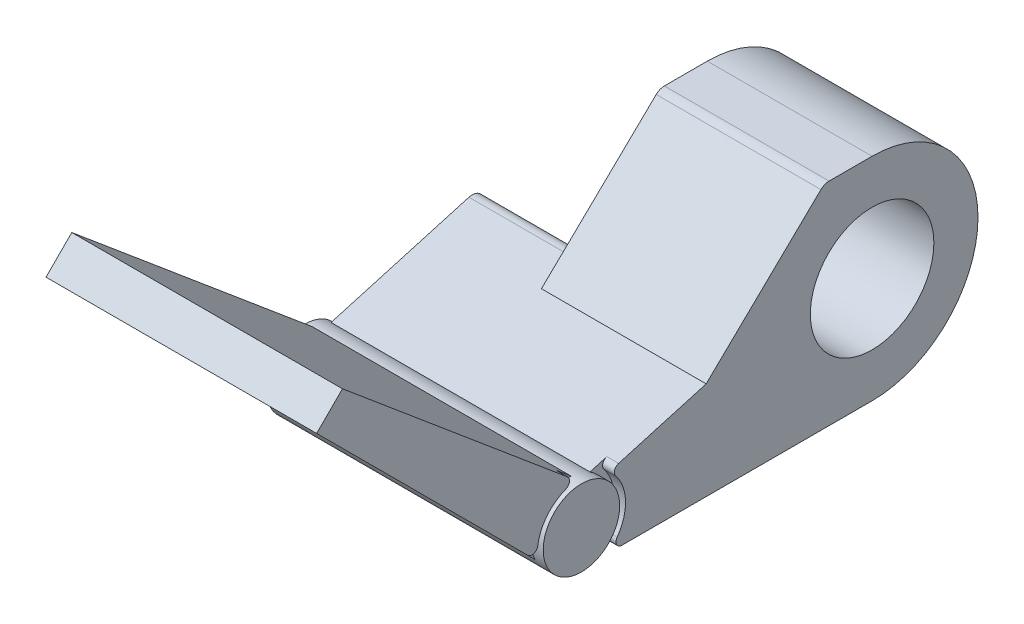
from build123d import *
from build123d.topology import SkipClean

# Parameters (mm, degrees)
SKETCH2_R           = 5.25
BOSS_EXTRUDE1_DEPTH = 14
CUT_EXTRUDE1_DEPTH  = 1
CUT_EXTRUDE2_DEPTH  = 1
BOSS_EXTRUDE2_DEPTH = 9
BOSS_EXTRUDE3_DEPTH = 9.5
FILLET1_R           = 1


with BuildPart() as part:
    # Sketch2 → Boss-Extrude1 (new body)
    with BuildSketch(Plane(origin=(0, 0, 0), x_dir=(0, 0, -1), z_dir=(1, 0, 0))):
        with BuildLine():
            ThreePointArc((0, 0), (9, 9), (0, 18))
            Line((0, 18), (-4.055356, 18))
            Line((-4.055356, 18), (-14.1, 8.3))
            Line((-14.1, 8.3), (-22.975774, 5.754913))
            ThreePointArc((-22.975774, 5.754913), (-23.743648, 6.106105), (-24.576075, 6.247636))
            Line((-24.576075, 6.247636), (-45.007969, 23.392031))
            Line((-45.007969, 23.392031), (-47.2, 21.2))
            Line((-47.2, 21.2), (-27.661634, 1.661634))
            ThreePointArc((-27.661634, 1.661634), (-25.892761, -0.023214), (-23.45, 0))
            Line((-23.45, 0), (0, 0))
        make_face()
        with Locations((0, 9)):
            Circle(SKETCH2_R, mode=Mode.SUBTRACT)
    extrude(amount=-BOSS_EXTRUDE1_DEPTH)

    # Sketch2<5> → Cut-Extrude1 (cut)
    with BuildSketch(Plane(origin=(0, 0, 0), x_dir=(0, 0, -1), z_dir=(1, 0, 0))):
        with BuildLine():
            Line((-29.259155, 3.259155), (-27.661634, 1.661634))
            ThreePointArc((-27.661634, 1.661634), (-27.39648, 4.814248), (-24.576075, 6.247636))
            Line((-24.576075, 6.247636), (-25.894138, 7.353622))
            ThreePointArc((-25.894138, 7.353622), (-25.722467, 6.887608), (-26.037234, 6.503471))
            ThreePointArc((-26.037234, 6.503471), (-27.62666, 5.344603), (-28.410825, 3.540625))
            ThreePointArc((-28.410825, 3.540625), (-28.748146, 3.138148), (-29.259155, 3.259155))
        make_face()
    extrude(amount=-CUT_EXTRUDE1_DEPTH, mode=Mode.SUBTRACT)

    # Sketch2<6> → Cut-Extrude2 (cut)
    with SkipClean():  # the faces are left unmerged after this step: merging them gives an invalid solid
        with BuildSketch(Plane(origin=(0, 0, 0), x_dir=(0, 0, -1), z_dir=(1, 0, 0))):
            with BuildLine():
                Line((-23.45, 0), (-21.263068, 0))
                ThreePointArc((-21.263068, 0), (-21.708635, 0.273129), (-21.667413, 0.794118))
                ThreePointArc((-21.667413, 0.794118), (-20.951416, 3.103029), (-21.793156, 5.369126))
                ThreePointArc((-21.793156, 5.369126), (-21.882672, 5.834611), (-21.543396, 6.165641))
                Line((-21.543396, 6.165641), (-22.975774, 5.754913))
                ThreePointArc((-22.975774, 5.754913), (-21.856918, 4.574606), (-21.45, 3))
                ThreePointArc((-21.45, 3), (-21.995837, 1.197224), (-23.45, 0))
            make_face()
        extrude(amount=-CUT_EXTRUDE2_DEPTH, mode=Mode.SUBTRACT)

    # Sketch3 → Boss-Extrude2 (add)
    with SkipClean():  # the faces are left unmerged after this step: merging them gives an invalid solid
        with BuildSketch(Plane.ZY.offset(14)):
            with BuildLine():
                Line((47.2, 21.2), (45.007969, 23.392031))
                Line((45.007969, 23.392031), (24.576075, 6.247636))
                ThreePointArc((24.576075, 6.247636), (23.743648, 6.106105), (22.975774, 5.754913))
                Line((22.975774, 5.754913), (11.25959, 9.114474))
                ThreePointArc((11.25959, 9.114474), (10.413299, 8.974404), (9.986911, 8.230078))
                ThreePointArc((9.986911, 8.230078), (9.041707, 4.689697), (6.886416, 1.72618))
                ThreePointArc((6.886416, 1.72618), (6.644894, 0.629987), (7.57392, 0))
                Line((7.57392, 0), (23.45, 0))
                ThreePointArc((23.45, 0), (25.892761, -0.023214), (27.661634, 1.661634))
                Line((27.661634, 1.661634), (47.2, 21.2))
            make_face()
        extrude(amount=BOSS_EXTRUDE2_DEPTH)

    # Sketch3<3> → Boss-Extrude3 (add)
    with SkipClean():  # the faces are left unmerged after this step: merging them gives an invalid solid
        with BuildSketch(Plane.ZY.offset(14)):
            with BuildLine():
                ThreePointArc((27.95, 3), (26.953857, 5.341501), (24.576075, 6.247636))
                ThreePointArc((24.576075, 6.247636), (23.743648, 6.106105), (22.975774, 5.754913))
                ThreePointArc((22.975774, 5.754913), (21.460978, 2.733093), (23.45, 0))
                ThreePointArc((23.45, 0), (25.892761, -0.023214), (27.661634, 1.661634))
                ThreePointArc((27.661634, 1.661634), (27.877091, 2.31546), (27.95, 3))
            make_face()
        extrude(amount=BOSS_EXTRUDE3_DEPTH)

    # Fillet1
    fillet1_edges = [part.edges().sort_by_distance(p)[0] for p in [
        (-7, 18, 4.055356),
    ]]
    fillet(fillet1_edges, radius=FILLET1_R)


solid = part.part
